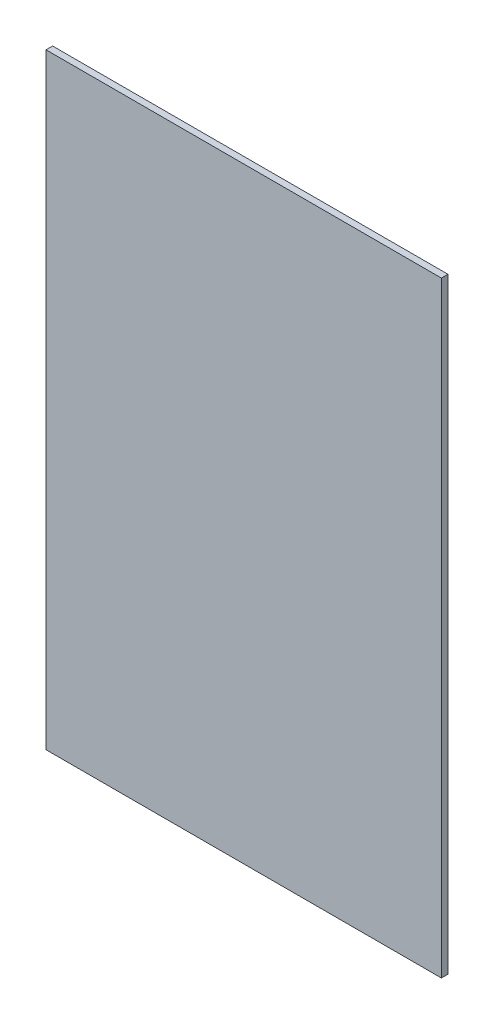
from build123d import *

# Parameters (mm, degrees)
CROQUIS1_W              = 600
CROQUIS1_H              = 920
SALIENTE_EXTRUIR1_DEPTH = 10


with BuildPart() as part:
    # Croquis1 → Saliente-Extruir1 (new body)
    with BuildSketch(Plane.XY):
        Rectangle(CROQUIS1_W, CROQUIS1_H)
    extrude(amount=SALIENTE_EXTRUIR1_DEPTH)


solid = part.part
